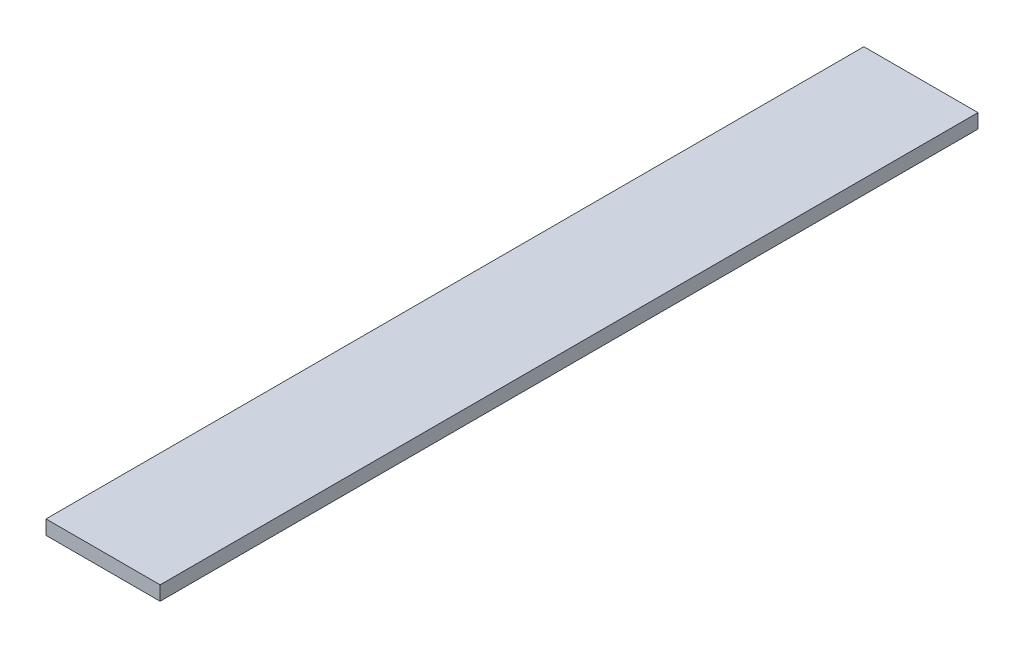
from build123d import *

# Parameters (mm, degrees)
SKETCH1_W           = 152.4
SKETCH1_H           = 1092.2
BOSS_EXTRUDE1_DEPTH = 9.525


with BuildPart() as part:
    # Sketch1 → Boss-Extrude1 (new, symmetric)
    with BuildSketch(Plane(origin=(0, 0, 0), x_dir=(1, 0, 0), z_dir=(0, 1, 0))):
        Rectangle(SKETCH1_W, SKETCH1_H)
    extrude(amount=BOSS_EXTRUDE1_DEPTH, both=True)


solid = part.part
